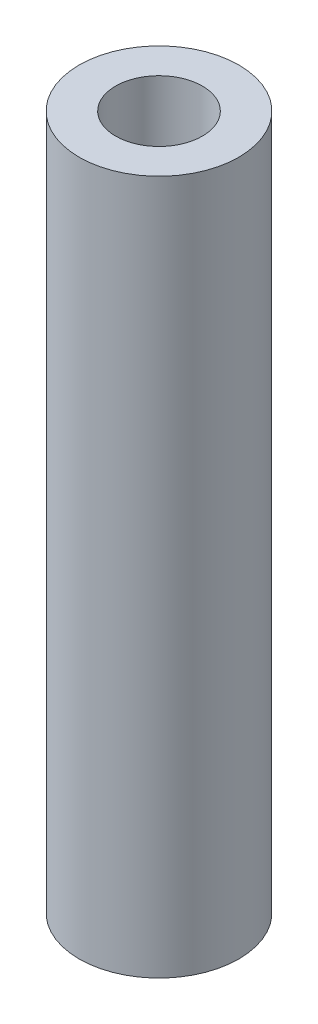
from build123d import *

# Parameters (mm, degrees)
SKETCH_1_R      = 2.3
SKETCH_1_R_2    = 1.25
EXTRUDE_1_DEPTH = 20


with BuildPart() as part:
    # 草图1 → 凸台-拉伸1 (new body)
    with BuildSketch(Plane(origin=(0, 0, 0), x_dir=(1, 0, 0), z_dir=(0, 1, 0))):
        with Locations(Location((0, 0, 0), (0, 0, 270))):
            Circle(SKETCH_1_R)
        with Locations(Location((0, 0, 0), (0, 0, 270))):
            Circle(SKETCH_1_R_2, mode=Mode.SUBTRACT)
    extrude(amount=EXTRUDE_1_DEPTH)


solid = part.part
